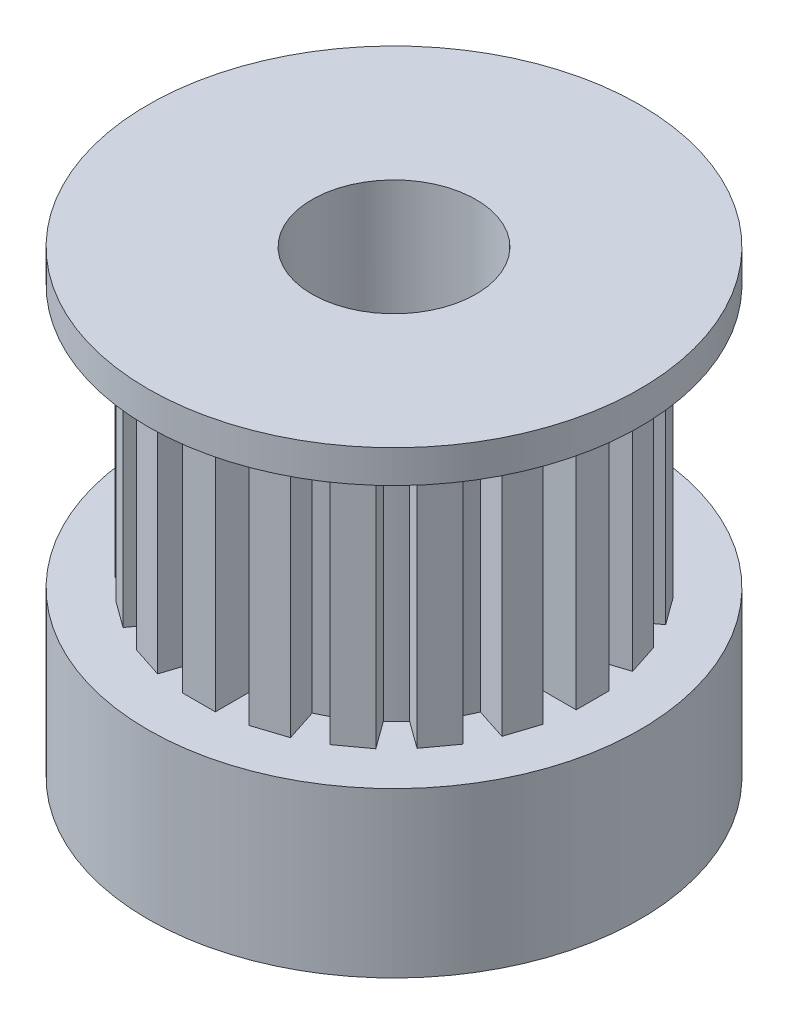
from build123d import *

# Parameters (mm, degrees)
IZIM1_R                     = 7.5
Y_KSEKLIK_EKSTR_ZYON1_DEPTH = 5
IZIM6_R                     = 5
Y_KSEKLIK_EKSTR_ZYON5_DEPTH = 8
Y_KSEKLIK_EKSTR_ZYON6_START = -8
Y_KSEKLIK_EKSTR_ZYON6_DEPTH = 8
DAIRESEL_KAPLAMA2_COUNT     = 20
IZIM8_R                     = 7.5
Y_KSEKLIK_EKSTR_ZYON7_DEPTH = 1
IZIM9_R                     = 2.5
KES_EKSTR_ZYON2_DEPTH       = 21
IZIM10_R                    = 1.2
KES_EKSTR_ZYON3_DEPTH       = 21


with BuildPart() as part:
    # Çizim1 → Yükseklik-Ekstrüzyon1 (new body)
    with BuildSketch(Plane(origin=(0, 0, 0), x_dir=(1, 0, 0), z_dir=(0, 1, 0))):
        with Locations(Location((0, 0, 0), (0, 0, 270))):
            Circle(IZIM1_R)
    extrude(amount=Y_KSEKLIK_EKSTR_ZYON1_DEPTH)

    # Çizim6 → Yükseklik-Ekstrüzyon5 (add)
    with BuildSketch(Plane(origin=(0, 5, 0), x_dir=(1, 0, 0), z_dir=(0, 1, 0))):
        with Locations(Location((0, 0, 0), (0, 0, 270))):
            Circle(IZIM6_R)
    extrude(amount=Y_KSEKLIK_EKSTR_ZYON5_DEPTH)

    # Çizim7 → Yükseklik-Ekstrüzyon6 (add)
    with BuildSketch(Plane(origin=(0, 13, 0), x_dir=(1, 0, 0), z_dir=(0, 1, 0)).offset(Y_KSEKLIK_EKSTR_ZYON6_START)):
        with BuildLine():
            Line((0, 6), (0, 5))
            ThreePointArc((0, 5), (0.223628846, 4.99499651), (0.446810123, 4.979996056))
            Line((0.446810123, 4.979996056), (0.446810123, 6))
            Line((0.446810123, 6), (0, 6))
        make_face()
        with BuildLine():
            ThreePointArc((-0.553189877, 4.969303871), (-0.277020438, 4.99232007), (0, 5))
            Line((0, 5), (0, 6))
            Line((0, 6), (-0.553189877, 6))
            Line((-0.553189877, 6), (-0.553189877, 4.969303871))
        make_face()
    y_kseklik_ekstr_zyon6 = extrude(amount=Y_KSEKLIK_EKSTR_ZYON6_DEPTH)

    # Dairesel Kaplama2: Yükseklik-Ekstrüzyon6 ×20 about axis
    dairesel_kaplama2_axis = Axis((0, 0, 0), (0, 1, 0))
    for i in range(1, DAIRESEL_KAPLAMA2_COUNT):
        add(y_kseklik_ekstr_zyon6.rotate(dairesel_kaplama2_axis, i * 360 / DAIRESEL_KAPLAMA2_COUNT))

    # Çizim8 → Yükseklik-Ekstrüzyon7 (add)
    with BuildSketch(Plane(origin=(0, 13, 0), x_dir=(1, 0, 0), z_dir=(0, 1, 0))):
        with Locations(Location((0, 0, 0), (0, 0, 270))):
            Circle(IZIM8_R)
    extrude(amount=Y_KSEKLIK_EKSTR_ZYON7_DEPTH)

    # Çizim9 → Kes-Ekstrüzyon2 (cut)
    with BuildSketch(Plane(origin=(0, 14, 0), x_dir=(1, 0, 0), z_dir=(0, 1, 0))):
        with Locations(Location((0, 0, 0), (0, 0, 270))):
            Circle(IZIM9_R)
    extrude(amount=-KES_EKSTR_ZYON2_DEPTH, mode=Mode.SUBTRACT)

    # Çizim10 → Kes-Ekstrüzyon3 (cut)
    with BuildSketch(Plane(origin=(0, 0, 0), x_dir=(0, 0, -1), z_dir=(1, 0, 0))):
        with Locations((0, 2.361227205)):
            Circle(IZIM10_R)
    extrude(amount=-KES_EKSTR_ZYON3_DEPTH, mode=Mode.SUBTRACT)


solid = part.part
